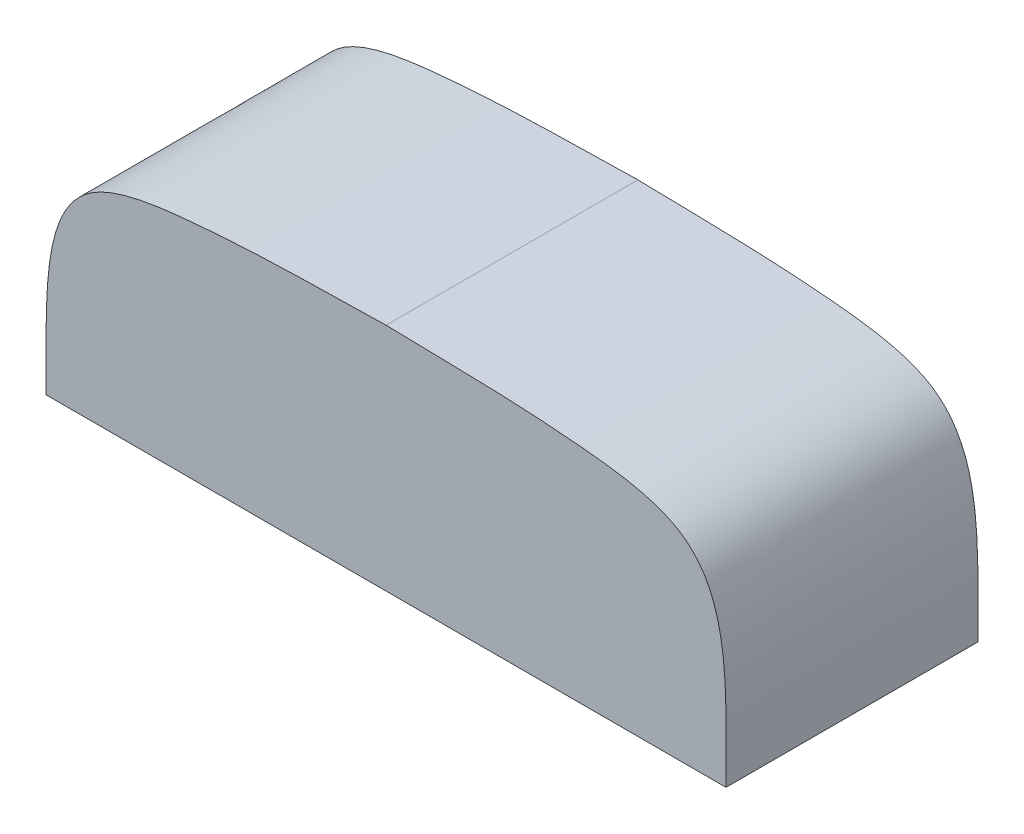
from build123d import *

# Parameters (mm, degrees)
BOSS_EXTRUDE1_DEPTH      = 127
BOSS_EXTRUDE1_DEPTH_BACK = 127


with BuildPart() as part:
    # Sketch1 → Boss-Extrude1 (new, two sides: drawn at the far end of the back side and taken through both)
    with BuildSketch(Plane.XY.offset(-BOSS_EXTRUDE1_DEPTH_BACK)):
        with BuildLine():
            Line((-342.9, 0), (342.9, 0))
            add(Edge.make_bspline(
                [(0, 232.258315543), (64.976578003, 230.63437227), (157.61608025, 231.087982089), (351.002633094, 205.179836695), (342.883010646, 85.402914772), (342.9, 0)],
                knots=[0, 0, 0, 0, 0.225226498, 0.337839747, 0.5719992, 0.5719992, 0.5719992, 0.5719992], degree=3))
            add(Edge.make_bspline(
                [(0, 232.258315543), (-64.976578003, 230.63437227), (-157.61608025, 231.087982089), (-351.002633094, 205.179836695), (-342.883010646, 85.402914772), (-342.9, 0)],
                knots=[0, 0, 0, 0, 0.225226498, 0.337839747, 0.5719992, 0.5719992, 0.5719992, 0.5719992], degree=3))
        make_face()
    extrude(amount=BOSS_EXTRUDE1_DEPTH + BOSS_EXTRUDE1_DEPTH_BACK)


solid = part.part
